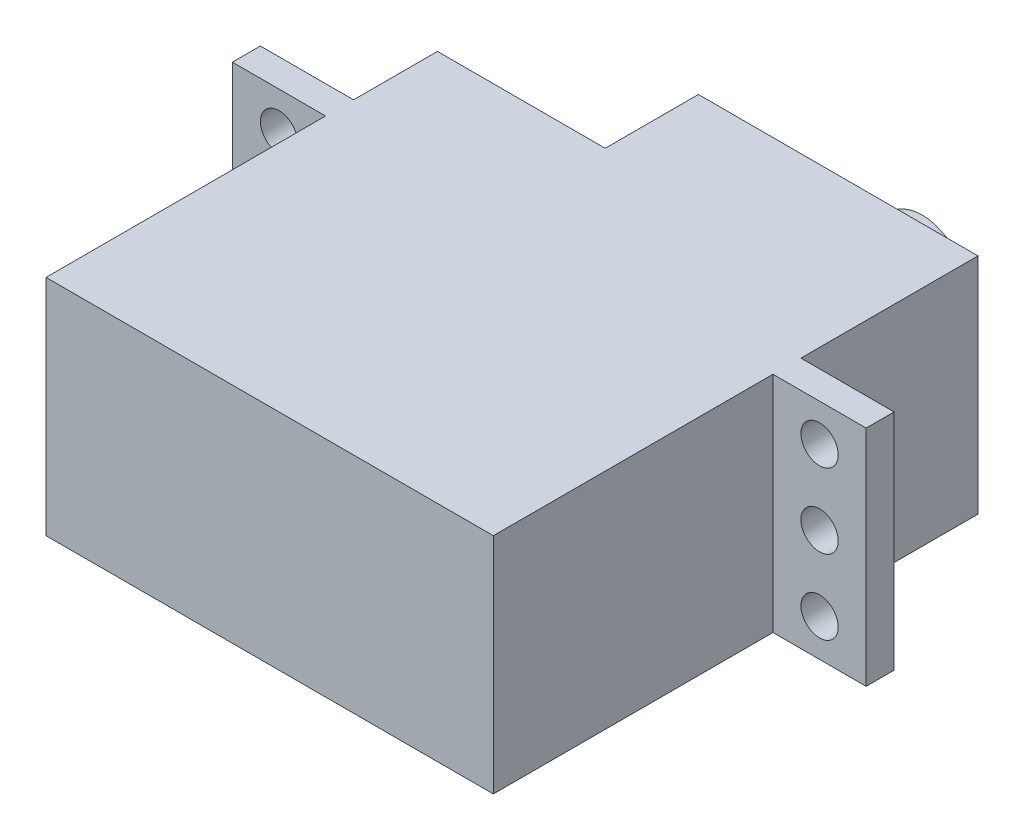
from build123d import *

# Parameters (mm, degrees)
SKETCH1_W           = 24
SKETCH1_H           = 12
BOSS_EXTRUDE1_DEPTH = 21
SKETCH2_W           = 34
SKETCH2_H           = 12
SKETCH2_R           = 1
BOSS_EXTRUDE2_DEPTH = 1.5
SKETCH3_W           = 15
SKETCH3_H           = 12
BOSS_EXTRUDE3_DEPTH = 5
SKETCH4_R           = 2.4
BOSS_EXTRUDE4_DEPTH = 4


with BuildPart() as part:
    # Sketch1 → Boss-Extrude1 (new body)
    with BuildSketch(Plane.XY):
        with Locations((12, -6)):
            Rectangle(SKETCH1_W, SKETCH1_H)
    extrude(amount=BOSS_EXTRUDE1_DEPTH)

    # Sketch2 → Boss-Extrude2 (add)
    with BuildSketch(Plane.XY.offset(6)):
        with Locations((12, -6)):
            Rectangle(SKETCH2_W, SKETCH2_H)
        with Locations((-2.5, -2)):
            Circle(SKETCH2_R, mode=Mode.SUBTRACT)
        with Locations((26.5, -2)):
            Circle(SKETCH2_R, mode=Mode.SUBTRACT)
        with Locations((26.5, -6)):
            Circle(SKETCH2_R, mode=Mode.SUBTRACT)
        with Locations((26.5, -10)):
            Circle(SKETCH2_R, mode=Mode.SUBTRACT)
        with Locations((-2.5, -6)):
            Circle(SKETCH2_R, mode=Mode.SUBTRACT)
        with Locations((-2.5, -10)):
            Circle(SKETCH2_R, mode=Mode.SUBTRACT)
    extrude(amount=-BOSS_EXTRUDE2_DEPTH)

    # Sketch3 → Boss-Extrude3 (add)
    with BuildSketch(Plane(origin=(0, 0, 0), x_dir=(-1, 0, 0), z_dir=(0, 0, -1))):
        with Locations((-16.5, -6)):
            Rectangle(SKETCH3_W, SKETCH3_H)
    extrude(amount=BOSS_EXTRUDE3_DEPTH)

    # Sketch4 → Boss-Extrude4 (add)
    with BuildSketch(Plane(origin=(0, 0, -5), x_dir=(-1, 0, 0), z_dir=(0, 0, -1))):
        with Locations((-17, -6)):
            Circle(SKETCH4_R)
    extrude(amount=BOSS_EXTRUDE4_DEPTH)


solid = part.part
